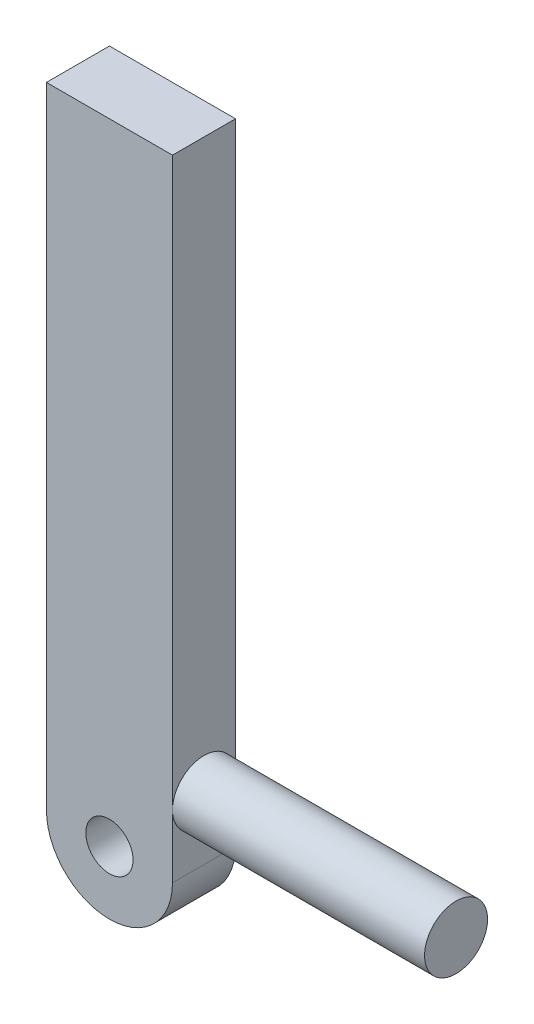
from build123d import *

# Parameters (mm, degrees)
SKETCH1_R           = 4.7625
BOSS_EXTRUDE1_DEPTH = 12.7
SKETCH2_R           = 6.35
BOSS_EXTRUDE2_DEPTH = 50.8


with BuildPart() as part:
    # Sketch1 → Boss-Extrude1 (new body)
    with BuildSketch(Plane.XY):
        with BuildLine():
            Line((-12.7, 0), (-12.7, 127))
            Line((-12.7, 127), (12.7, 127))
            Line((12.7, 127), (12.7, 0))
            ThreePointArc((12.7, 0), (0, -12.7), (-12.7, 0))
        make_face()
        Circle(SKETCH1_R, mode=Mode.SUBTRACT)
    extrude(amount=BOSS_EXTRUDE1_DEPTH)

    # Sketch2 → Boss-Extrude2 (add)
    with BuildSketch(Plane(origin=(12.7, 0, 0), x_dir=(0, 0, -1), z_dir=(1, 0, 0))):
        with Locations((-6.35, 12.7)):
            Circle(SKETCH2_R)
    extrude(amount=BOSS_EXTRUDE2_DEPTH)


solid = part.part
